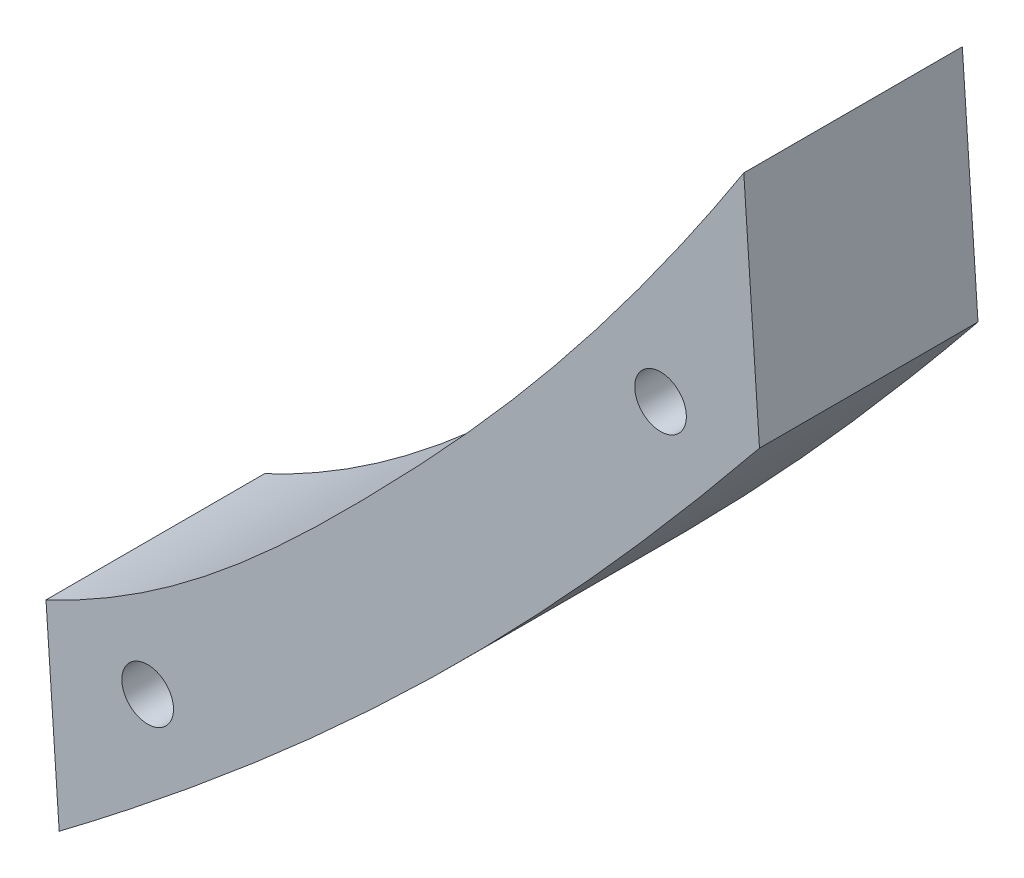
from build123d import *

# Parameters (mm, degrees)
SKETCH_1_R      = 2.6
EXTRUDE_1_DEPTH = 22


with BuildPart() as part:
    # 草图1 → 凸台-拉伸1 (new body)
    with BuildSketch(Plane.XY):
        with BuildLine():
            Line((23.847340939, 22.540535696), (25.426595378, -0.670423871))
            add(Edge.make_bspline(
                [(-45.075558205, -69.325666874), (-42.754308832, -67.574416213), (-40.451669282, -65.798512541), (-32.294309234, -59.368468615), (-26.546100007, -54.578255108), (-15.345136182, -44.664021117), (-9.895646996, -39.536602487), (0.681335287, -28.95909339), (5.808236447, -23.509575428), (15.763503709, -12.344368812), (20.592346629, -6.630730984), (25.344702666, -0.771444989), (25.385653413, -0.720937959), (25.426595378, -0.670423871)],
                knots=[0.201401882, 0.201401882, 0.201401882, 0.201401882, 0.25, 0.25, 0.375, 0.375, 0.5, 0.5, 0.625, 0.625, 0.75, 0.75, 0.751086715, 0.751086715, 0.751086715, 0.751086715], degree=3))
            Line((-45.075558205, -69.325666874), (-46.403218206, -49.812495445))
            add(Edge.make_bspline(
                [(23.847340939, 22.540535696), (23.64915353, 22.233291982), (23.450485571, 21.926356885), (19.302193238, 15.53957719), (15.159702589, 9.585176101), (8.596754946, 0.915295883), (6.3513379, -1.931247492), (1.744627248, -7.528266651), (-0.617237974, -10.279137899), (-5.445852464, -15.685888726), (-7.913195994, -18.342470215), (-11.674958808, -22.267979722), (-12.938982587, -23.567073503), (-15.483103595, -26.149104874), (-16.762445153, -27.432760042), (-20.640021965, -31.243741747), (-23.278577451, -33.732226441), (-28.749348744, -38.491244165), (-31.58193298, -40.761476786), (-37.50215526, -44.948079537), (-40.590801141, -46.863006315), (-44.66457019, -48.977283832), (-45.52963212, -49.403999667), (-46.403218206, -49.812495445)],
                knots=[0.243696274, 0.243696274, 0.243696274, 0.243696274, 0.25, 0.25, 0.375, 0.375, 0.4375, 0.4375, 0.5, 0.5, 0.5625, 0.5625, 0.59375, 0.59375, 0.625, 0.625, 0.6875, 0.6875, 0.75, 0.75, 0.8125, 0.8125, 0.829122533, 0.829122533, 0.829122533, 0.829122533], degree=3))
        make_face()
        with Locations((-36.167886121, -52.931465967)):
            Circle(SKETCH_1_R, mode=Mode.SUBTRACT)
        with Locations((15.466595378, -1.598123556)):
            Circle(SKETCH_1_R, mode=Mode.SUBTRACT)
    extrude(amount=EXTRUDE_1_DEPTH)


solid = part.part
